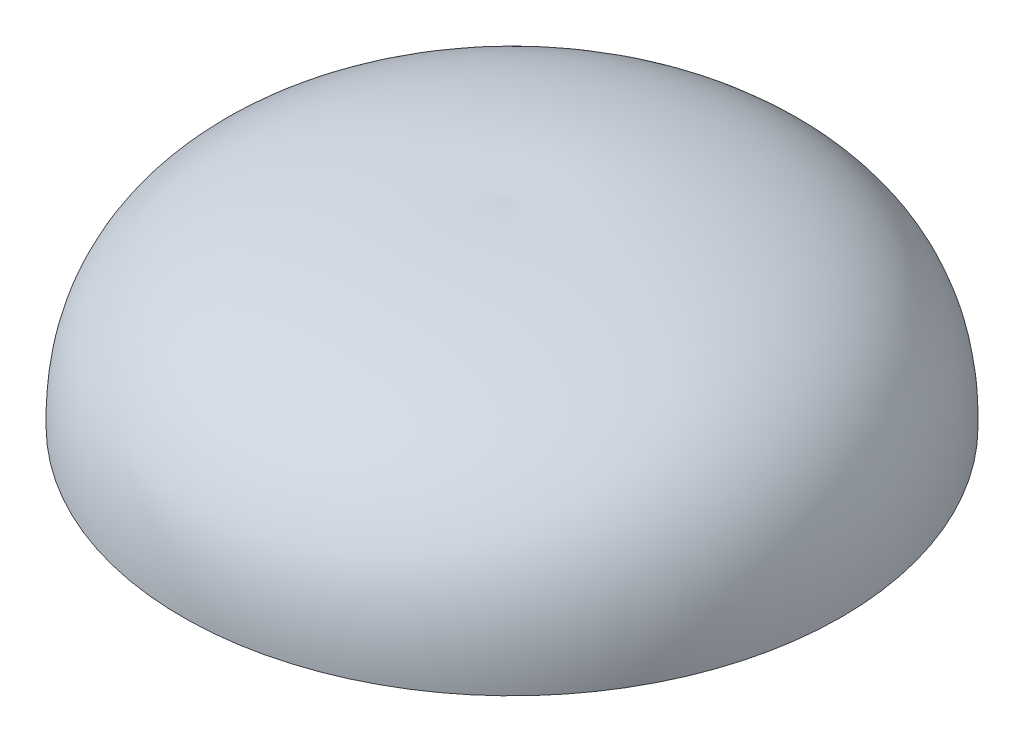
from build123d import *


with BuildPart() as part:
    # Sketch2 → Revolve1 (revolve)
    with BuildSketch(Plane.XY):
        with BuildLine():
            Line((0, 0), (0, 15))
            add(Edge.make_bspline(
                [(0, 15), (4.187171854, 15.278694267), (14.966445749, 14.589548555), (25.25425243, 9.13904922), (25, 0)],
                knots=[0, 0, 0, 0, 0.386239218, 1, 1, 1, 1], degree=3))
            Line((25, 0), (0, 0))
        make_face()
    revolve(axis=Axis((0, 0, 0), (0, 1, 0)))


solid = part.part
